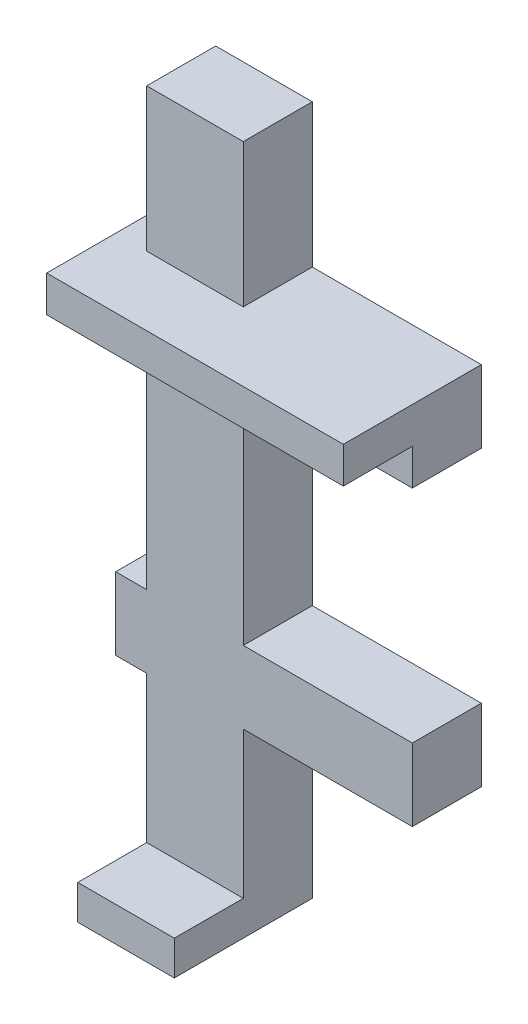
from build123d import *

# Parameters (mm, degrees)
SKETCH1_W               = 5.6
SKETCH1_H               = 40
BOSS_EXTRUDE1_DEPTH     = 4
SKETCH2_W               = 5.6
SKETCH2_H               = 2
BOSS_EXTRUDE2_DEPTH     = 4
SKETCH4_W               = 4
SKETCH4_H               = 4.2
BOSS_EXTRUDE3_DEPTH     = 1.8
MIRROR2_COPY_1_SKETCH_W = 4
MIRROR2_COPY_1_SKETCH_H = 4.2
MIRROR2_COPY_1_DEPTH    = 1.8
SKETCH8_W               = 4
SKETCH8_H               = 4.2
BOSS_EXTRUDE4_DEPTH     = 8
SKETCH9_W               = 17.2
SKETCH9_H               = 2.1
BOSS_EXTRUDE5_DEPTH     = 4


with BuildPart() as part:
    # Sketch1 → Boss-Extrude1 (new body)
    with BuildSketch(Plane.XY):
        Rectangle(SKETCH1_W, SKETCH1_H)
    extrude(amount=BOSS_EXTRUDE1_DEPTH)

    # Sketch2 → Boss-Extrude2 (add)
    with BuildSketch(Plane.XY.offset(4)):
        with Locations((0, -19)):
            Rectangle(SKETCH2_W, SKETCH2_H)
    extrude(amount=BOSS_EXTRUDE2_DEPTH)

    # Sketch4 → Boss-Extrude3 (add)
    with BuildSketch(Plane.ZY.offset(2.8)):
        with Locations((2, 9.6)):
            Rectangle(SKETCH4_W, SKETCH4_H)
    boss_extrude3 = extrude(amount=BOSS_EXTRUDE3_DEPTH)

    # Mirror1: Boss-Extrude3 across plane
    add(boss_extrude3.mirror(Plane.ZY))

    # Mirror2: Boss-Extrude3 across plane
    add(boss_extrude3.mirror(Plane(origin=(0, 1.1, 0), x_dir=(0, 0, 1), z_dir=(0, -1, 0))))

    # Mirror2 copy 1 sketch → Mirror2 copy 1 (add)
    with BuildSketch(Plane(origin=(2.8, 2.2, 0), x_dir=(0, 0, 1), z_dir=(1, 0, 0))):
        with Locations((2, 9.6)):
            Rectangle(MIRROR2_COPY_1_SKETCH_W, MIRROR2_COPY_1_SKETCH_H)
    extrude(amount=MIRROR2_COPY_1_DEPTH)

    # Sketch8 → Boss-Extrude4 (add)
    with BuildSketch(Plane(origin=(4.6, 0, 0), x_dir=(0, 0, -1), z_dir=(1, 0, 0))):
        with Locations((-2, 9.6)):
            Rectangle(SKETCH8_W, SKETCH8_H)
        with Locations((-2, -7.4)):
            Rectangle(SKETCH8_W, SKETCH8_H)
    extrude(amount=BOSS_EXTRUDE4_DEPTH)

    # Sketch9 → Boss-Extrude5 (add)
    with BuildSketch(Plane.XY.offset(4)):
        with Locations((4, 10.65)):
            Rectangle(SKETCH9_W, SKETCH9_H)
    extrude(amount=BOSS_EXTRUDE5_DEPTH)


solid = part.part
